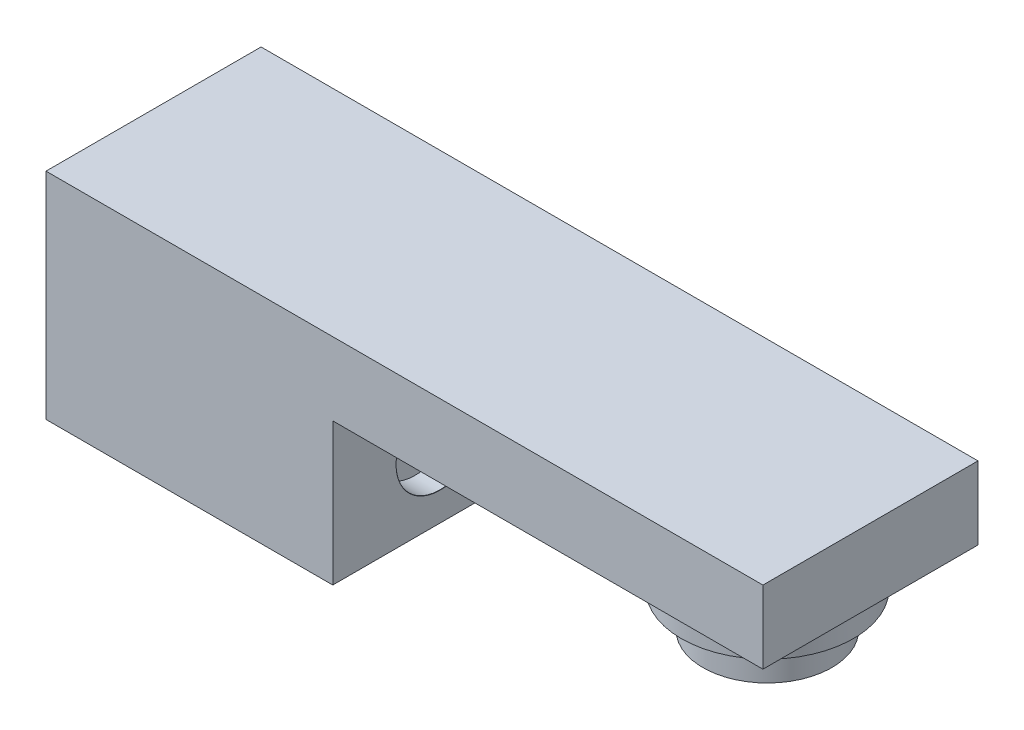
from build123d import *

# Parameters (mm, degrees)
SKETCH_1_W      = 30
SKETCH_1_H      = 30
EXTRUDE_1_DEPTH = 40
SKETCH_2_W      = 30
SKETCH_2_H      = 10.165772452
EXTRUDE_2_DEPTH = 60
SKETCH_3_R      = 12
EXTRUDE_3_DEPTH = 5
SKETCH_4_R      = 9
EXTRUDE_4_DEPTH = 5


with BuildPart() as part:
    # Эскиз1 → Бобышка-Вытянуть1 (new body)
    with BuildSketch(Plane(origin=(0, 0, 0), x_dir=(0, 0, -1), z_dir=(1, 0, 0))):
        with Locations((-24.657846844, 7.360988518)):
            Rectangle(SKETCH_1_W, SKETCH_1_H)
    extrude(amount=EXTRUDE_1_DEPTH)

    # Эскиз2 → Бобышка-Вытянуть2 (add)
    with BuildSketch(Plane(origin=(40, 0, 0), x_dir=(0, 0, -1), z_dir=(1, 0, 0))):
        with Locations((-24.657846844, 17.278102292)):
            Rectangle(SKETCH_2_W, SKETCH_2_H)
    extrude(amount=EXTRUDE_2_DEPTH)

    # Эскиз3 → Бобышка-Вытянуть3 (add)
    with BuildSketch(Plane.XZ.offset(-12.195216066)):
        with Locations(Location((85.620234383, 24.657846844, 0), (0, 0, 90))):
            Circle(SKETCH_3_R)
    extrude(amount=EXTRUDE_3_DEPTH)

    # Эскиз4 → Бобышка-Вытянуть4 (add)
    with BuildSketch(Plane.XZ.offset(-7.195216066)):
        with Locations(Location((85.620234383, 24.657846844, 0), (0, 0, 270))):
            Circle(SKETCH_4_R)
    extrude(amount=EXTRUDE_4_DEPTH)

    # Эскиз13 → Цековка для  болта с шестигранной головкой M51 (revolve, cut)
    with BuildSketch(Plane(origin=(40, 2.482471753, 24.681970174), x_dir=(0, 0, -1), z_dir=(0, 1, 0))):
        Polygon((0, 0), (0, 40), (2.75, 40), (2.75, 3.5), (6.119, 3.5), (6.119, 0.025), (6.144, 0), align=None)
    revolve(axis=Axis((46.35, 2.482471753, 24.681970174), (-1, 0, 0)), mode=Mode.SUBTRACT)


solid = part.part
